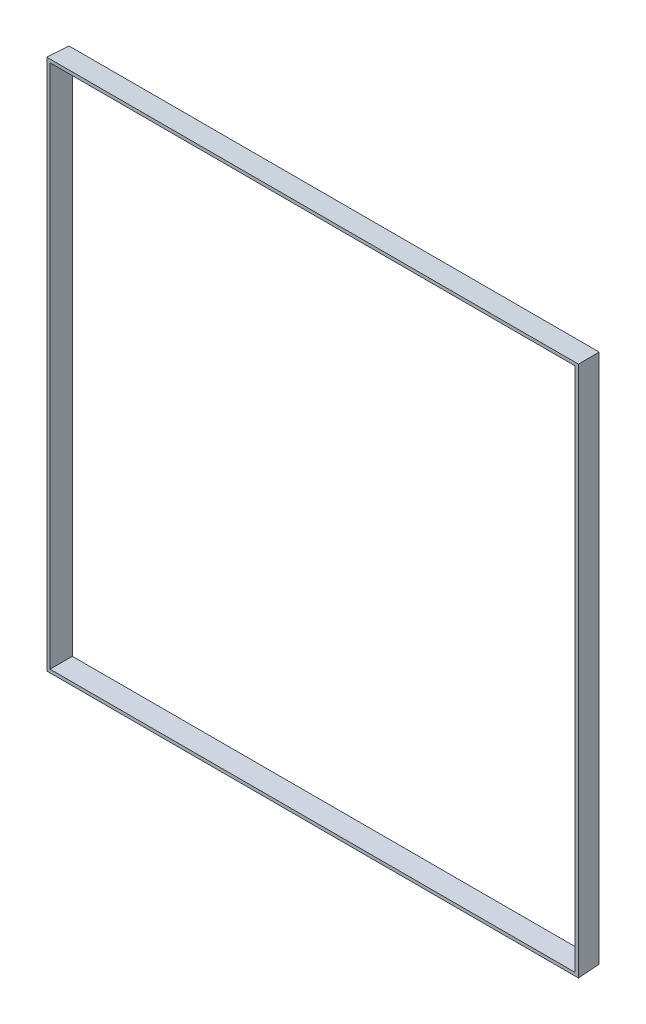
from build123d import *

# Parameters (mm, degrees)
SKETCH2_W                    = 246.6
SKETCH2_H                    = 246.6
BOSS_EXTRUDE1_DEPTH          = 10
BOSS_EXTRUDE1_DRAFT          = -2
SKETCH3_W                    = 243.6
SKETCH3_H                    = 243.6
CUT_EXTRUDE1_DEPTH           = 175.659039274
CUT_EXTRUDE1_TAPER           = 2
CUT_EXTRUDE1_OTHER_WAY_DEPTH = 175.659039274


with BuildPart() as part:
    # Sketch2 → Boss-Extrude1 (with draft: the straight prism first)
    with BuildSketch(Plane.XY):
        Rectangle(SKETCH2_W, SKETCH2_H)
    extrude(amount=-BOSS_EXTRUDE1_DEPTH)
    # Boss-Extrude1: the draft: its side faces are tilted about the plane it starts from
    boss_extrude1_sides = [part.faces().sort_by_distance(p)[0] for p in [
        (0, -123.3, -5),
        (123.3, 0, -5),
        (0, 123.3, -5),
        (-123.3, 0, -5),
    ]]
    draft(boss_extrude1_sides, Plane.XY, BOSS_EXTRUDE1_DRAFT)

    # Sketch3 → Cut-Extrude1 (cut)
    with BuildSketch(Plane.XY):
        Rectangle(SKETCH3_W, SKETCH3_H)
    extrude(amount=-CUT_EXTRUDE1_DEPTH, taper=CUT_EXTRUDE1_TAPER, mode=Mode.SUBTRACT)

    # Sketch3 → Cut-Extrude1 other way (cut)
    with BuildSketch(Plane.XY):
        Rectangle(SKETCH3_W, SKETCH3_H)
    extrude(amount=CUT_EXTRUDE1_OTHER_WAY_DEPTH, mode=Mode.SUBTRACT)


solid = part.part
